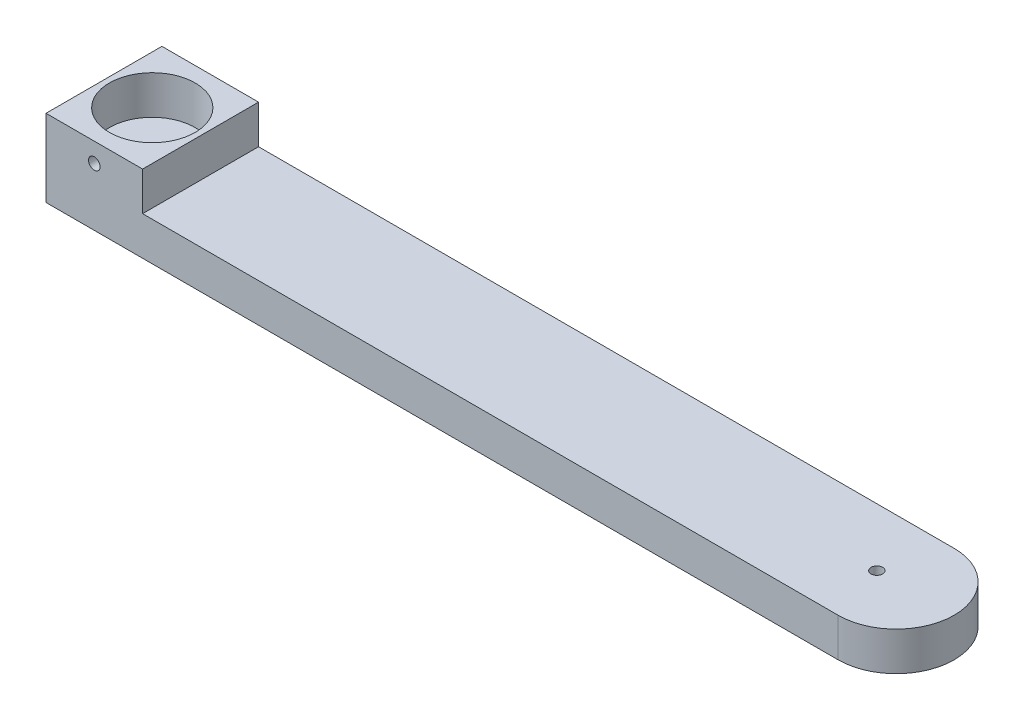
from build123d import *

# Parameters (mm, degrees)
SKETCH1_R               = 15
BOSS_EXTRUDE1_DEPTH     = 10
SKETCH2_W               = 25
SKETCH2_H               = 30
SKETCH2_R               = 11.1
BOSS_EXTRUDE3_DEPTH     = 10
SKETCH6_R               = 1.5
CUT_EXTRUDE2_DEPTH      = 10
CUT_EXTRUDE3_START      = -10
SKETCH4_R               = 4
CUT_EXTRUDE3_DEPTH      = 6.5
SKETCH7_R               = 1.5
CUT_EXTRUDE4_DEPTH      = 14
CUT_EXTRUDE5_REACH      = 117.758
CUT_EXTRUDE5_END_RADIUS = 4
SKETCH8_R               = 1.5


with BuildPart() as part:
    # Sketch1 → Boss-Extrude1 (new body)
    with BuildSketch(Plane(origin=(0, 0, 0), x_dir=(1, 0, 0), z_dir=(0, 1, 0))):
        with BuildLine():
            Line((-110, 15), (-110, -15))
            Line((-110, -15), (95, -15))
            ThreePointArc((95, -15), (80, 0), (95, 15))
            Line((95, 15), (-110, 15))
        make_face()
        with Locations((95, 0)):
            Circle(SKETCH1_R)
    extrude(amount=BOSS_EXTRUDE1_DEPTH)

    # Sketch2 → Boss-Extrude3 (add)
    with BuildSketch(Plane(origin=(0, 10, 0), x_dir=(1, 0, 0), z_dir=(0, 1, 0))):
        with Locations((-97.5, 0)):
            Rectangle(SKETCH2_W, SKETCH2_H)
        with Locations(Location((-97.5, 0, 0), (0, 0, 270))):
            Circle(SKETCH2_R, mode=Mode.SUBTRACT)
    extrude(amount=BOSS_EXTRUDE3_DEPTH)

    # Sketch6 → Cut-Extrude2 (cut)
    with BuildSketch(Plane.XY.offset(15)):
        with Locations((-97.5, 15)):
            Circle(SKETCH6_R)
    extrude(amount=-CUT_EXTRUDE2_DEPTH, mode=Mode.SUBTRACT)

    # Sketch4 → Cut-Extrude3 (cut)
    with BuildSketch(Plane(origin=(0, 10, 0), x_dir=(1, 0, 0), z_dir=(0, 1, 0)).offset(CUT_EXTRUDE3_START)):
        with Locations(Location((90, 0, 0), (0, 0, 90))):
            Circle(SKETCH4_R)
    extrude(amount=CUT_EXTRUDE3_DEPTH, mode=Mode.SUBTRACT)

    # Sketch7 → Cut-Extrude4 (cut)
    with BuildSketch(Plane(origin=(0, 6.5, 0), x_dir=(-1, 0, 0), z_dir=(0, -1, 0))):
        with Locations(Location((-90, 0, 0), (0, 0, 90))):
            Circle(SKETCH7_R)
    extrude(amount=-CUT_EXTRUDE4_DEPTH, mode=Mode.SUBTRACT)

    # Cut-Extrude5: up to this cylinder (the profile starts outside it)
    cut_extrude5_end = Plane(origin=(90, 3, 0), z_dir=(0, -1, 0)) * Cylinder(CUT_EXTRUDE5_END_RADIUS, 244.516, mode=Mode.PRIVATE)
    # Sketch8 → Cut-Extrude5 (cut, up to the surface)
    with BuildSketch(Plane(origin=(0, 0, -15), x_dir=(-1, 0, 0), z_dir=(0, 0, -1)), mode=Mode.PRIVATE) as cut_extrude5_sk1:
        with Locations((-90, 3)):
            Circle(SKETCH8_R)
    cut_extrude5_tool1 = extrude(cut_extrude5_sk1.sketch, amount=-CUT_EXTRUDE5_REACH, mode=Mode.PRIVATE) - cut_extrude5_end
    add(cut_extrude5_tool1.solids().sort_by_distance((90, 3, -15))[0], mode=Mode.SUBTRACT)


solid = part.part
